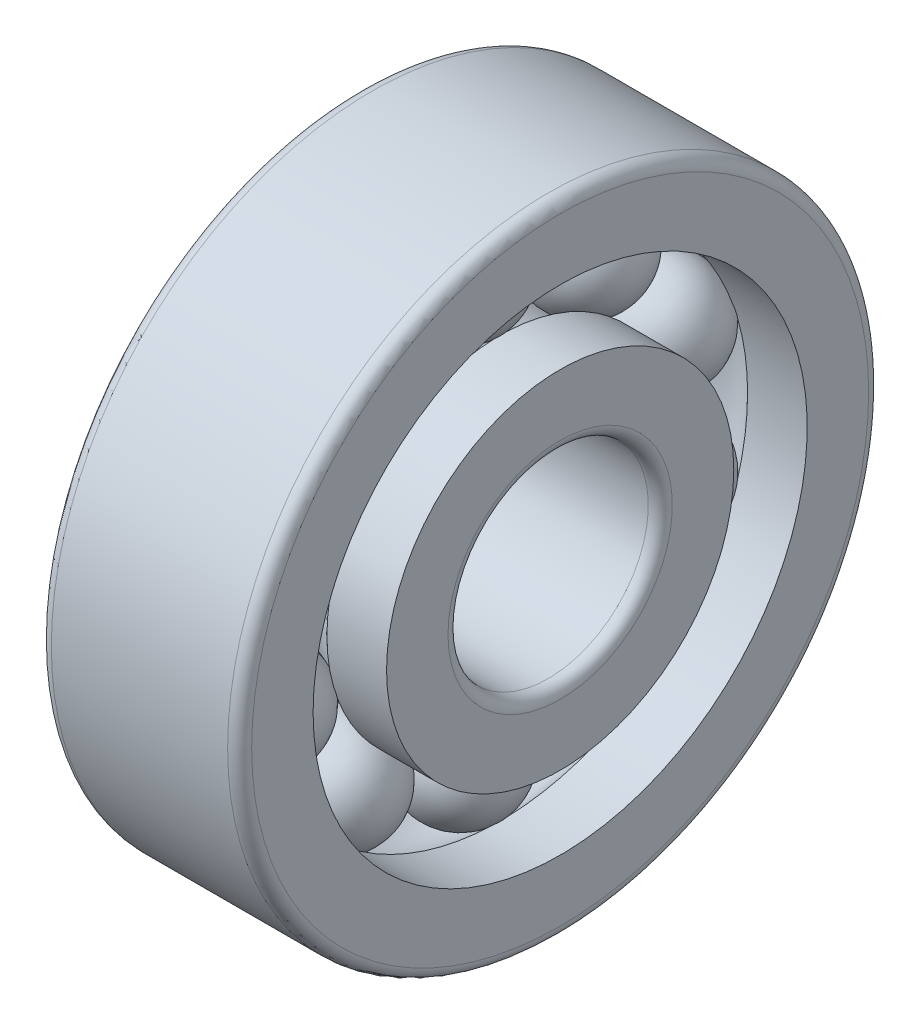
from build123d import *

# Parameters (mm, degrees)
CIRCULAR_PATTERN1_COUNT = 10
FILLET1_R               = 0.3


with BuildPart() as part:
    # Sketch1 → Revolve1 (revolve)
    with BuildSketch(Plane.XY):
        with BuildLine():
            Line((-1.375, 5.25), (1.375, 5.25))
            ThreePointArc((1.375, 5.25), (0, 6.625), (-1.375, 5.25))
        make_face()
    revolve1 = revolve(axis=Axis((-4.596601835, 5.25, 0), (1, 0, 0)))

    # Sketch2 → Revolve2 (revolve)
    with BuildSketch(Plane.XY, mode=Mode.PRIVATE) as revolve2_sk:
        with BuildLine():
            Line((-2.5, 4.333333333), (-2.5, 2.5))
            Line((-2.5, 2.5), (2.5, 2.5))
            Line((2.5, 2.5), (2.5, 4.333333333))
            Line((2.5, 4.333333333), (1.011408534, 4.333333333))
            ThreePointArc((1.011408534, 4.333333333), (0, 3.885), (-1.011408534, 4.333333333))
            Line((-1.011408534, 4.333333333), (-2.5, 4.333333333))
        make_face()
    revolve(revolve2_sk.sketch.rotate(Axis((-6.971390126, 0, 0), (1, 0, 0)), 90), axis=Axis((-6.971390126, 0, 0), (1, 0, 0)))

    # Sketch3 → Revolve3 (revolve)
    with BuildSketch(Plane.XY, mode=Mode.PRIVATE) as revolve3_sk:
        with BuildLine():
            Line((-2.5, 8), (2.5, 8))
            Line((2.5, 8), (2.5, 6.166666667))
            Line((2.5, 6.166666667), (1.011408534, 6.166666667))
            ThreePointArc((1.011408534, 6.166666667), (0, 6.615), (-1.011408534, 6.166666667))
            Line((-1.011408534, 6.166666667), (-2.5, 6.166666667))
            Line((-2.5, 6.166666667), (-2.5, 8))
        make_face()
    revolve(revolve3_sk.sketch.rotate(Axis((-8.710676495, 0, 0), (1, 0, 0)), 90), axis=Axis((-8.710676495, 0, 0), (1, 0, 0)))

    # Circular-Pattern1: Revolve1 ×10 about axis
    circular_pattern1_axis = Axis((0, 0, 0), (1, 0, 0))
    for i in range(1, CIRCULAR_PATTERN1_COUNT):
        add(revolve1.rotate(circular_pattern1_axis, i * 360 / CIRCULAR_PATTERN1_COUNT))

    # Fillet1
    fillet1_edges = [part.edges().sort_by_distance(p)[0] for p in [
        (-2.5, 0, -8),
        (2.5, 0, -8),
        (-2.5, 0, -2.5),
        (2.5, 0, -2.5),
    ]]
    fillet(fillet1_edges, radius=FILLET1_R)


solid = part.part
